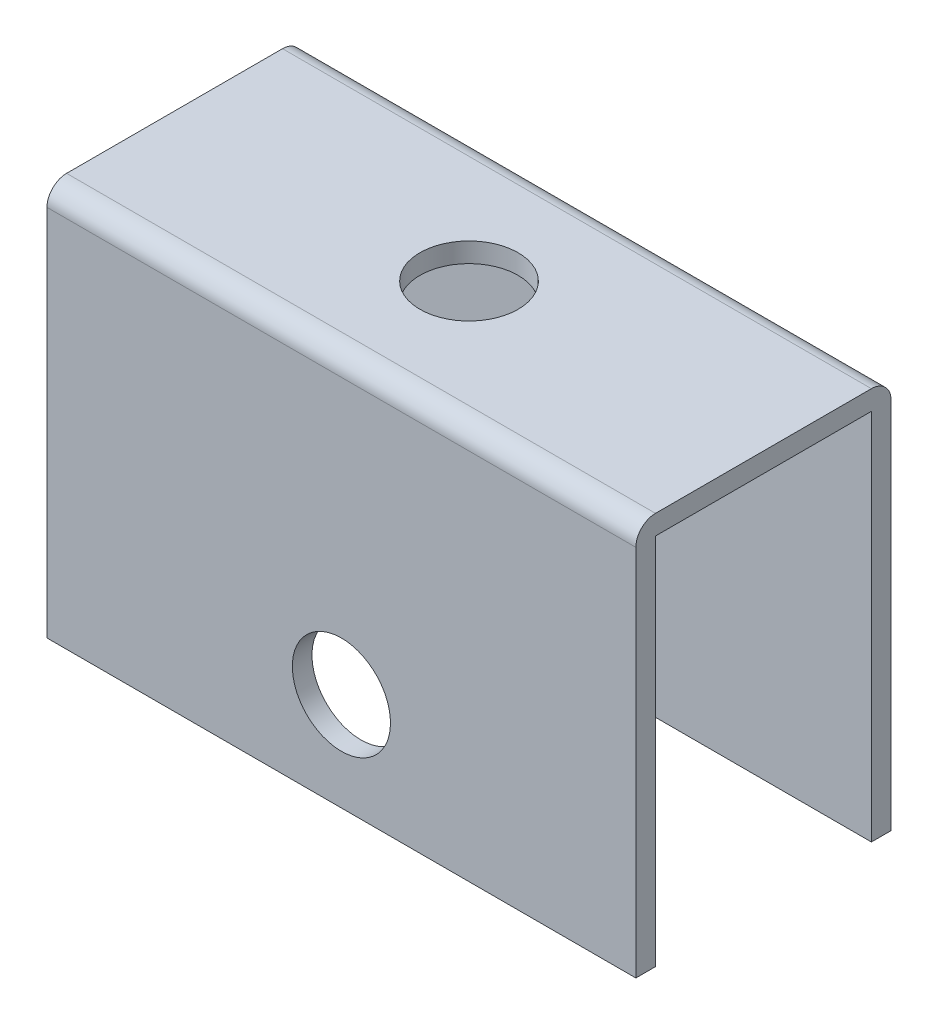
from build123d import *

# Parameters (mm, degrees)
SKETCH1_W           = 76.2
SKETCH1_H           = 50.8
SKETCH1_R           = 6.35
BOSS_EXTRUDE1_DEPTH = 33.02
SKETCH2_W           = 27.94
SKETCH2_H           = 60.96
CUT_EXTRUDE1_DEPTH  = 87.844230666
SKETCH3_R           = 6.35
CUT_EXTRUDE2_DEPTH  = 70.792248853
FILLET1_R           = 2.54


with BuildPart() as part:
    # Sketch1 → Boss-Extrude1 (new body)
    with BuildSketch(Plane.XY):
        Rectangle(SKETCH1_W, SKETCH1_H)
        with Locations((0, -12.7)):
            Circle(SKETCH1_R, mode=Mode.SUBTRACT)
    extrude(amount=BOSS_EXTRUDE1_DEPTH)

    # Sketch2 → Cut-Extrude1 (cut, through all)
    with BuildSketch(Plane(origin=(38.1, 0, 0), x_dir=(0, 0, -1), z_dir=(1, 0, 0))):
        with Locations((-16.51, -7.62)):
            Rectangle(SKETCH2_W, SKETCH2_H)
    extrude(amount=-CUT_EXTRUDE1_DEPTH, mode=Mode.SUBTRACT)

    # Sketch3 → Cut-Extrude2 (cut, through all)
    with BuildSketch(Plane.XZ.offset(-22.86)):
        with Locations((0, 16.51)):
            Circle(SKETCH3_R)
    extrude(amount=-CUT_EXTRUDE2_DEPTH, mode=Mode.SUBTRACT)

    # Fillet1
    fillet1_edges = [part.edges().sort_by_distance(p)[0] for p in [
        (0, 25.4, 0),
        (0, 25.4, 33.02),
    ]]
    fillet(fillet1_edges, radius=FILLET1_R)


solid = part.part
